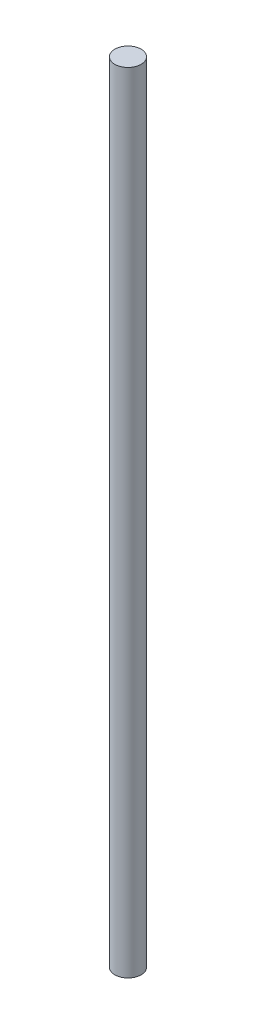
from build123d import *

# Parameters (mm, degrees)
SKETCH_1_R      = 1
EXTRUDE_1_DEPTH = 60


with BuildPart() as part:
    # 草图1 → 凸台-拉伸1 (new body)
    with BuildSketch(Plane(origin=(0, 0, 0), x_dir=(1, 0, 0), z_dir=(0, 1, 0))):
        with Locations(Location((0, 0, 0), (0, 0, 270))):
            Circle(SKETCH_1_R)
    extrude(amount=EXTRUDE_1_DEPTH)


solid = part.part
